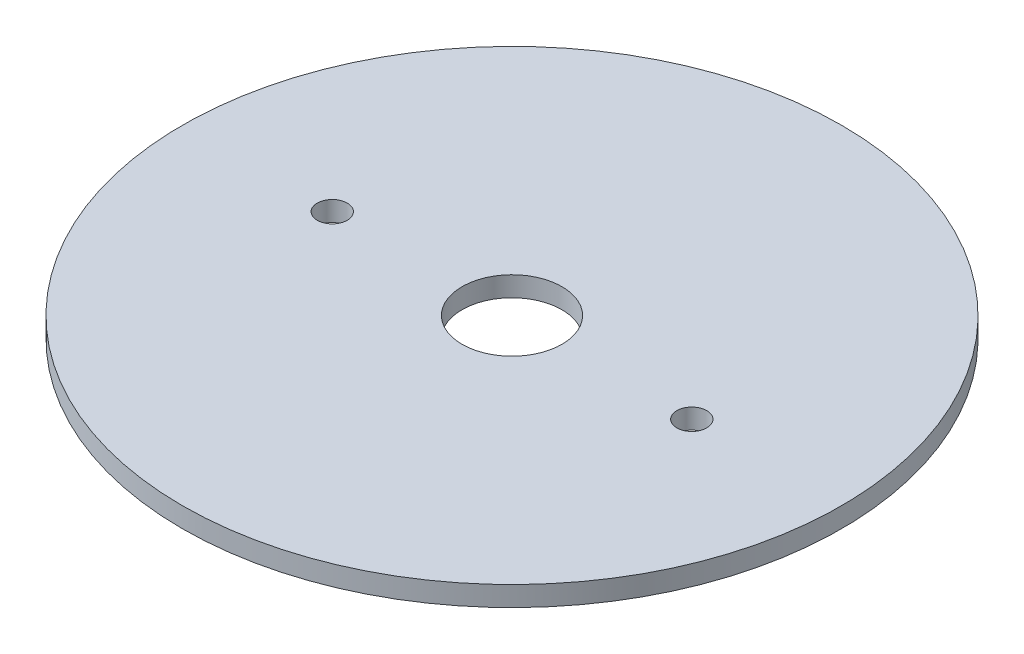
from build123d import *

# Parameters (mm, degrees)
SKETCH1_R           = 33
SKETCH1_R_2         = 5
SKETCH1_R_3         = 1.5
BOSS_EXTRUDE2_DEPTH = 2


with BuildPart() as part:
    # Sketch1 → Boss-Extrude2 (new body)
    with BuildSketch(Plane(origin=(0, 0, 0), x_dir=(1, 0, 0), z_dir=(0, 1, 0))):
        with Locations(Location((0, 0, 0), (0, 0, 270))):
            Circle(SKETCH1_R)
        with Locations(Location((0, 0, 0), (0, 0, 270))):
            Circle(SKETCH1_R_2, mode=Mode.SUBTRACT)
        with Locations(Location((18, 0, 0), (0, 0, 270))):
            Circle(SKETCH1_R_3, mode=Mode.SUBTRACT)
        with Locations(Location((-18, 0, 0), (0, 0, 270))):
            Circle(SKETCH1_R_3, mode=Mode.SUBTRACT)
    extrude(amount=BOSS_EXTRUDE2_DEPTH)


solid = part.part
